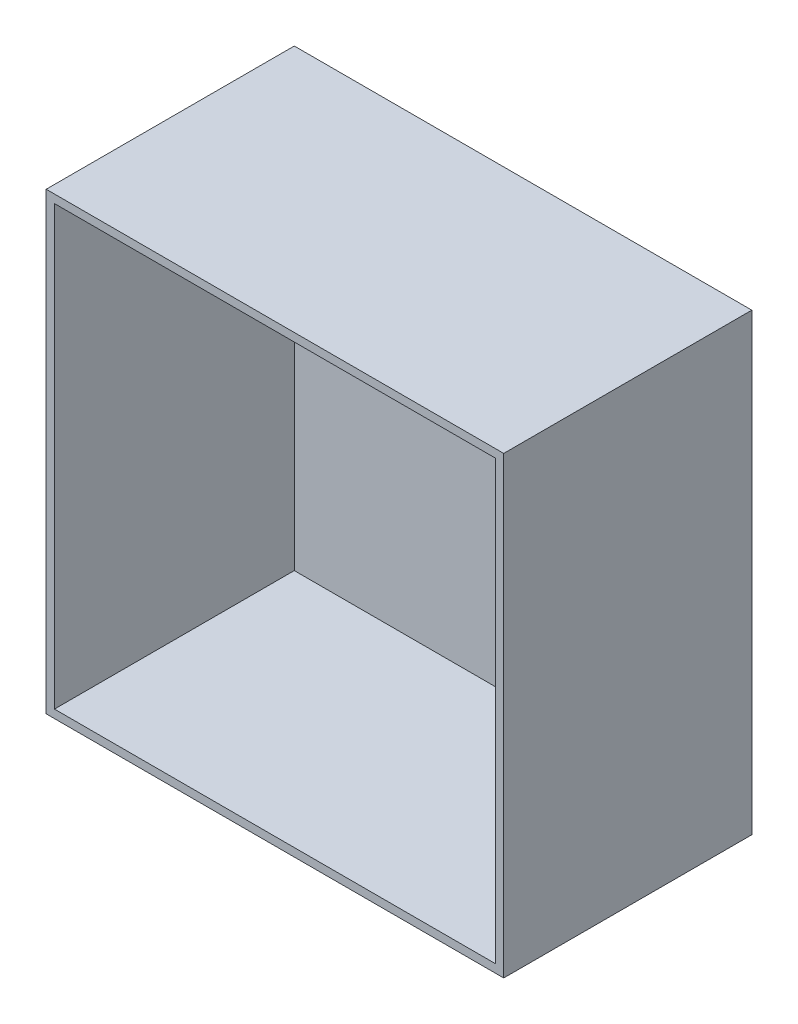
from build123d import *

# Parameters (mm, degrees)
SKICA1_W                 = 110.835
SKICA1_H                 = 110.06
P_IDAT_VYSUNUT_M1_DEPTH  = 60.1
SKICA2_W                 = 106.835
SKICA2_H                 = 106.06
ODEBRAT_VYSUNUT_M1_DEPTH = 58.1


with BuildPart() as part:
    # Skica1 → Přidat vysunutím1 (new body)
    with BuildSketch(Plane.XY):
        with Locations((-55.4175, 55.03)):
            Rectangle(SKICA1_W, SKICA1_H)
    extrude(amount=P_IDAT_VYSUNUT_M1_DEPTH)

    # Skica2 → Odebrat vysunutím1 (cut)
    with BuildSketch(Plane.XY.offset(60.1)):
        with Locations((-55.4175, 55.03)):
            Rectangle(SKICA2_W, SKICA2_H)
    extrude(amount=-ODEBRAT_VYSUNUT_M1_DEPTH, mode=Mode.SUBTRACT)


solid = part.part
